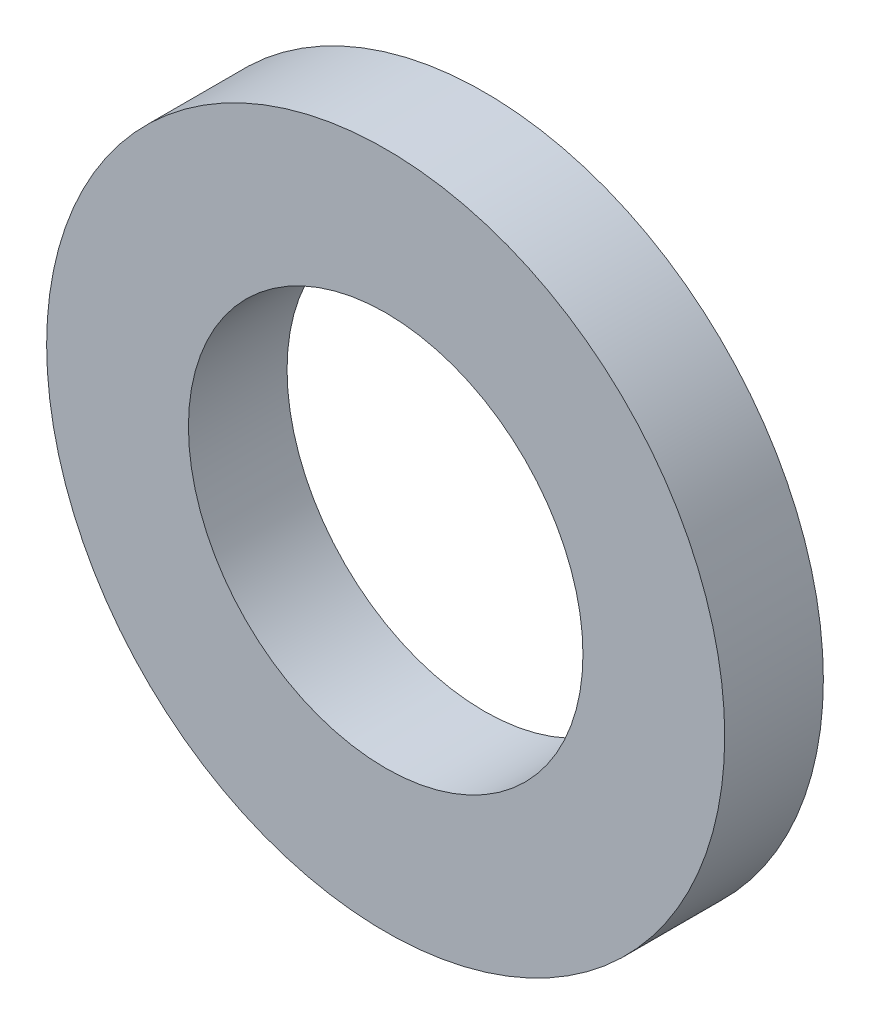
from build123d import *

# Parameters (mm, degrees)
SKETCH1_R           = 2.75
SKETCH1_R_2         = 1.6
BOSS_EXTRUDE1_DEPTH = 0.8


with BuildPart() as part:
    # Sketch1 → Boss-Extrude1 (new body)
    with BuildSketch(Plane(origin=(0, 0, 0), x_dir=(0, 1, 0), z_dir=(0, 0, 1))):
        with Locations(Location((0, 0, 0), (0, 0, 270))):
            Circle(SKETCH1_R)
        with Locations(Location((0, 0, 0), (0, 0, 270))):
            Circle(SKETCH1_R_2, mode=Mode.SUBTRACT)
    extrude(amount=BOSS_EXTRUDE1_DEPTH)


solid = part.part
